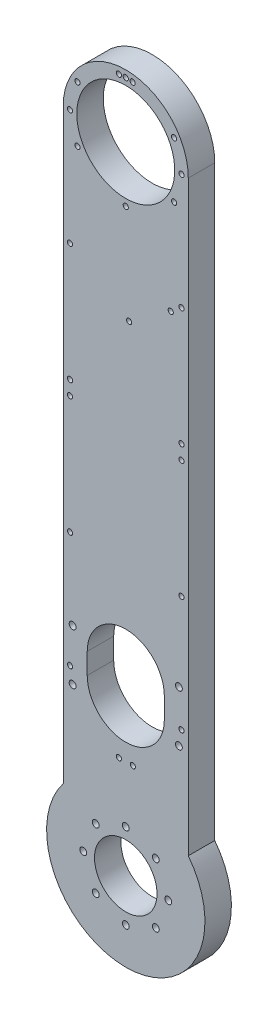
from build123d import *

# Parameters (mm, degrees)
SKETCH1_R             = 15
SKETCH1_R_2           = 23.5
BOSS_EXTRUDE1_DEPTH   = 12.7
M3X0_5_TAPPED_HOLE1_D = 2.5
M4X0_7_TAPPED_HOLE1_D = 3.3


with BuildPart() as part:
    # Sketch1 → Boss-Extrude1 (new body)
    with BuildSketch(Plane.XY.offset(12.7)):
        with BuildLine():
            Line((30, 23.323807579), (30, 305))
            ThreePointArc((30, 305), (0, 335), (-30, 305))
            Line((-30, 305), (-30, 23.323807579))
            ThreePointArc((-30, 23.323807579), (0, -38), (30, 23.323807579))
        make_face()
        with Locations(Location((0, 0, 0), (0, 0, 180))):
            Circle(SKETCH1_R, mode=Mode.SUBTRACT)
        with Locations(Location((0, 305, 0), (0, 0, 180))):
            Circle(SKETCH1_R_2, mode=Mode.SUBTRACT)
        with BuildLine():
            Line((18.5, 84.022471071), (18.5, 74.022471071))
            ThreePointArc((18.5, 74.022471071), (0, 55.522471071), (-18.5, 74.022471071))
            Line((-18.5, 74.022471071), (-18.5, 84.022471071))
            ThreePointArc((-18.5, 84.022471071), (0, 102.522471071), (18.5, 84.022471071))
        make_face(mode=Mode.SUBTRACT)
    extrude(amount=-BOSS_EXTRUDE1_DEPTH)

    # M3x0.5 Tapped Hole1 (through all)
    with Locations(Plane.XY.offset(12.7)):
        with Locations((0, 331.75), (3.299999999, 331.545668196), (23.166179551, 318.375), (26.749999999, 305), (23.166179551, 291.625), (0, 278.25), (-23.166179551, 291.625), (-26.750000001, 305), (-23.166179551, 318.375), (-3.300000001, 331.545668196), (26.749999999, 249.511235535), (21.578861519, 245.43367635), (1.619921459, 231.265288591), (-26.750000001, 249.511235535), (-26.750000001, 192.911235535), (-26.75, 186.111235535), (26.749999999, 192.911235535), (26.75, 186.111235535), (-26.75, 129.511235535), (26.75, 129.511235535), (-26.75, 74.022471071), (-3.3, 47.476802874), (3.4, 47.489425637), (26.75, 74.022471071)):
            Hole(M3X0_5_TAPPED_HOLE1_D / 2)

    # M4x0.7 Tapped Hole1 (through all)
    with Locations(Plane(origin=(0, 20.4, 12.7), x_dir=(1, 0, 0), z_dir=(0, 0, 1))):
        with Locations((0, 0), (14.424978336, -5.975021664), (20.4, -20.4), (14.424978336, -34.824978336), (0, -40.8), (-14.424978336, -34.824978336), (-20.4, -20.4), (-14.424978336, -5.975021664), (25.5016, 46.372471071), (25.5016, 70.872471071), (-25.5016, 70.872471071), (-25.5016, 46.372471071)):
            Hole(M4X0_7_TAPPED_HOLE1_D / 2)


solid = part.part
